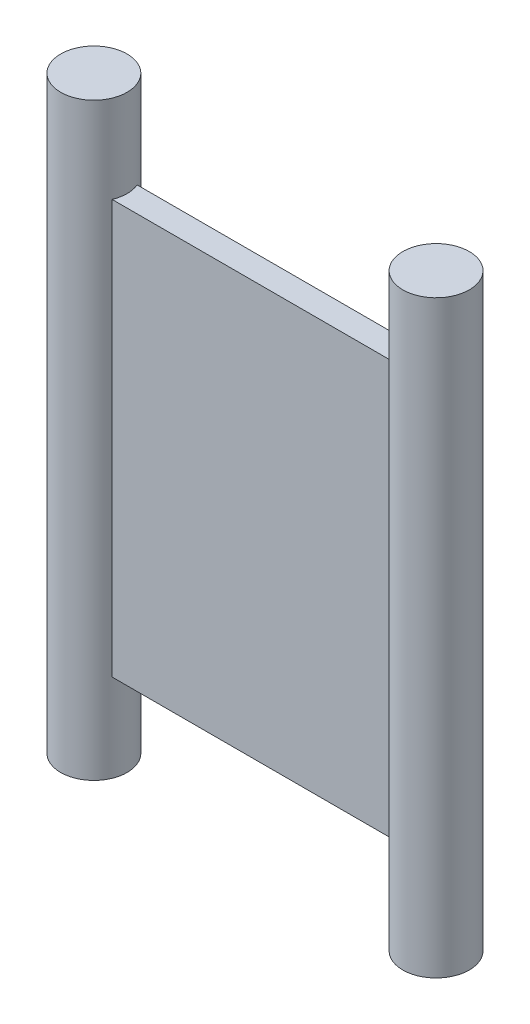
from build123d import *

# Parameters (mm, degrees)
SKETCH1_W           = 13.65
SKETCH1_H           = 1
BOSS_EXTRUDE1_DEPTH = 16.5
SKETCH2_R           = 1.325
BOSS_EXTRUDE2_DEPTH = 11.75


with BuildPart() as part:
    # Sketch1 → Boss-Extrude1 (new body)
    with BuildSketch(Plane(origin=(0, 0, 0), x_dir=(1, 0, 0), z_dir=(0, 1, 0))):
        Rectangle(SKETCH1_W, SKETCH1_H)
    extrude(amount=BOSS_EXTRUDE1_DEPTH)

    # Sketch2 → Boss-Extrude2 (add, symmetric)
    with BuildSketch(Plane(origin=(0, 8.25, 0), x_dir=(1, 0, 0), z_dir=(0, 1, 0))):
        with Locations(Location((-6.825, 0, 0), (0, 0, 270))):
            Circle(SKETCH2_R)
        with Locations(Location((6.825, 0, 0), (0, 0, 270))):
            Circle(SKETCH2_R)
    extrude(amount=BOSS_EXTRUDE2_DEPTH, both=True)


solid = part.part
